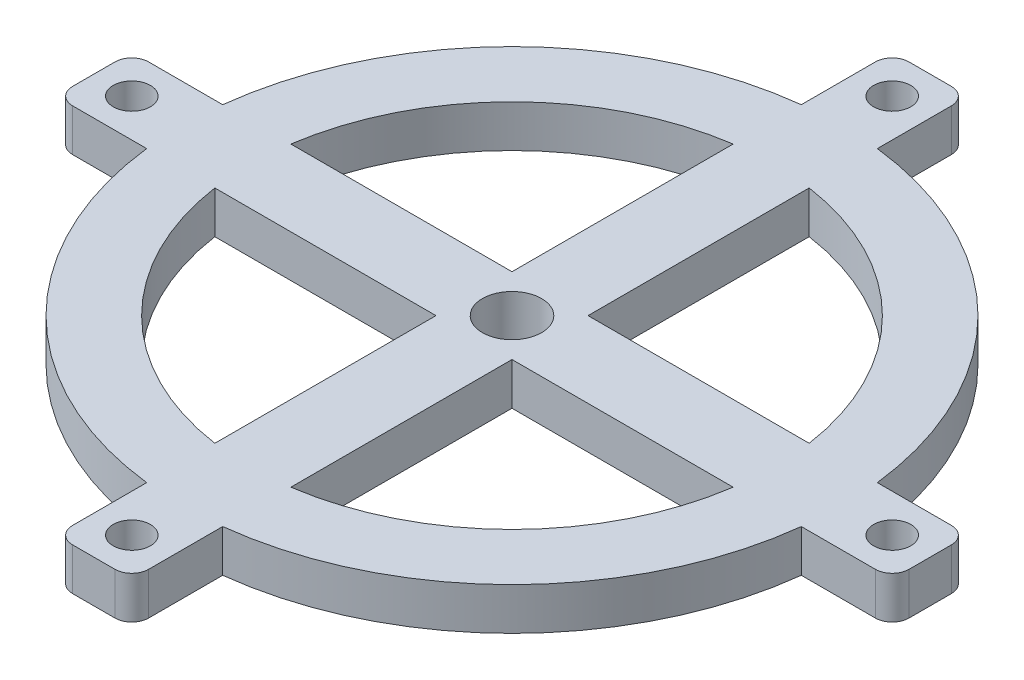
from build123d import *

# Parameters (mm, degrees)
CROQUIS1_W              = 4.5
CROQUIS1_H              = 4.5
SALIENTE_EXTRUIR1_DEPTH = 2.5
CROQUIS2_R              = 1.75
CROQUIS2_R_2            = 1.1
CORTAR_EXTRUIR1_DEPTH   = 2.5


with BuildPart() as part:
    # Croquis1 → Saliente-Extruir1 (new body)
    with BuildSketch(Plane(origin=(0, 0, 0), x_dir=(1, 0, 0), z_dir=(0, 1, 0))):
        with BuildLine():
            ThreePointArc((-19.369757355, -2.25), (-13.788582233, -13.788582233), (-2.25, -19.369757355))
            Line((-2.25, -19.369757355), (-2.25, -15.335824073))
            ThreePointArc((-2.25, -15.335824073), (-10.960155108, -10.960155108), (-15.335824073, -2.25))
            Line((-15.335824073, -2.25), (-19.369757355, -2.25))
        make_face()
        with BuildLine():
            Line((-23.75, -2.25), (-19.369757355, -2.25))
            ThreePointArc((-19.369757355, -2.25), (-19.5, 0), (-19.369757355, 2.25))
            Line((-19.369757355, 2.25), (-23.75, 2.25))
            ThreePointArc((-23.75, 2.25), (-24.457106781, 1.957106781), (-24.75, 1.25))
            Line((-24.75, 1.25), (-24.75, -1.25))
            ThreePointArc((-24.75, -1.25), (-24.457106781, -1.957106781), (-23.75, -2.25))
        make_face()
        with BuildLine():
            Line((15.335824073, -2.25), (19.369757355, -2.25))
            ThreePointArc((19.369757355, -2.25), (19.467412109, -1.126883218), (19.5, 0))
            ThreePointArc((19.5, 0), (19.467412109, 1.126883218), (19.369757355, 2.25))
            Line((19.369757355, 2.25), (15.335824073, 2.25))
            ThreePointArc((15.335824073, 2.25), (15.458901532, 1.127990884), (15.5, 0))
            ThreePointArc((15.5, 0), (15.458901532, -1.127990884), (15.335824073, -2.25))
        make_face()
        with BuildLine():
            ThreePointArc((-19.369757355, 2.25), (-19.5, 0), (-19.369757355, -2.25))
            Line((-19.369757355, -2.25), (-15.335824073, -2.25))
            ThreePointArc((-15.335824073, -2.25), (-15.5, 0), (-15.335824073, 2.25))
            Line((-15.335824073, 2.25), (-19.369757355, 2.25))
        make_face()
        with BuildLine():
            Line((-2.25, 23.75), (-2.25, 19.369757355))
            ThreePointArc((-2.25, 19.369757355), (0, 19.5), (2.25, 19.369757355))
            Line((2.25, 19.369757355), (2.25, 23.75))
            ThreePointArc((2.25, 23.75), (1.957106781, 24.457106781), (1.25, 24.75))
            Line((1.25, 24.75), (-1.25, 24.75))
            ThreePointArc((-1.25, 24.75), (-1.957106781, 24.457106781), (-2.25, 23.75))
        make_face()
        with BuildLine():
            ThreePointArc((-2.25, 19.369757355), (-13.788582233, 13.788582233), (-19.369757355, 2.25))
            Line((-19.369757355, 2.25), (-15.335824073, 2.25))
            ThreePointArc((-15.335824073, 2.25), (-10.960155108, 10.960155108), (-2.25, 15.335824073))
            Line((-2.25, 15.335824073), (-2.25, 19.369757355))
        make_face()
        with BuildLine():
            ThreePointArc((-2.25, -19.369757355), (0, -19.5), (2.25, -19.369757355))
            Line((2.25, -19.369757355), (2.25, -15.335824073))
            ThreePointArc((2.25, -15.335824073), (0, -15.5), (-2.25, -15.335824073))
            Line((-2.25, -15.335824073), (-2.25, -19.369757355))
        make_face()
        with BuildLine():
            ThreePointArc((2.25, 19.369757355), (0, 19.5), (-2.25, 19.369757355))
            Line((-2.25, 19.369757355), (-2.25, 15.335824073))
            ThreePointArc((-2.25, 15.335824073), (0, 15.5), (2.25, 15.335824073))
            Line((2.25, 15.335824073), (2.25, 19.369757355))
        make_face()
        with BuildLine():
            Line((15.335824073, 2.25), (19.369757355, 2.25))
            ThreePointArc((19.369757355, 2.25), (13.788582233, 13.788582233), (2.25, 19.369757355))
            Line((2.25, 19.369757355), (2.25, 15.335824073))
            ThreePointArc((2.25, 15.335824073), (10.960155108, 10.960155108), (15.335824073, 2.25))
        make_face()
        with BuildLine():
            ThreePointArc((19.5, 0), (19.467412109, -1.126883218), (19.369757355, -2.25))
            Line((19.369757355, -2.25), (23.75, -2.25))
            ThreePointArc((23.75, -2.25), (24.457106781, -1.957106781), (24.75, -1.25))
            Line((24.75, -1.25), (24.75, 1.25))
            ThreePointArc((24.75, 1.25), (24.457106781, 1.957106781), (23.75, 2.25))
            Line((23.75, 2.25), (19.369757355, 2.25))
            ThreePointArc((19.369757355, 2.25), (19.467412109, 1.126883218), (19.5, 0))
        make_face()
        with BuildLine():
            Line((-1.25, -24.75), (1.25, -24.75))
            ThreePointArc((1.25, -24.75), (1.957106781, -24.457106781), (2.25, -23.75))
            Line((2.25, -23.75), (2.25, -19.369757355))
            ThreePointArc((2.25, -19.369757355), (0, -19.5), (-2.25, -19.369757355))
            Line((-2.25, -19.369757355), (-2.25, -23.75))
            ThreePointArc((-2.25, -23.75), (-1.957106781, -24.457106781), (-1.25, -24.75))
        make_face()
        with BuildLine():
            Line((2.25, -15.335824073), (2.25, -19.369757355))
            ThreePointArc((2.25, -19.369757355), (13.788582233, -13.788582233), (19.369757355, -2.25))
            Line((19.369757355, -2.25), (15.335824073, -2.25))
            ThreePointArc((15.335824073, -2.25), (10.960155108, -10.960155108), (2.25, -15.335824073))
        make_face()
        with BuildLine():
            ThreePointArc((-2.25, -15.335824073), (0, -15.5), (2.25, -15.335824073))
            Line((2.25, -15.335824073), (2.25, -2.25))
            Line((2.25, -2.25), (-2.25, -2.25))
            Line((-2.25, -2.25), (-2.25, -15.335824073))
        make_face()
        with BuildLine():
            Line((-15.335824073, -2.25), (-2.25, -2.25))
            Line((-2.25, -2.25), (-2.25, 2.25))
            Line((-2.25, 2.25), (-15.335824073, 2.25))
            ThreePointArc((-15.335824073, 2.25), (-15.5, 0), (-15.335824073, -2.25))
        make_face()
        with BuildLine():
            Line((-2.25, 2.25), (2.25, 2.25))
            Line((2.25, 2.25), (2.25, 15.335824073))
            ThreePointArc((2.25, 15.335824073), (0, 15.5), (-2.25, 15.335824073))
            Line((-2.25, 15.335824073), (-2.25, 2.25))
        make_face()
        Rectangle(CROQUIS1_W, CROQUIS1_H)
        with BuildLine():
            Line((2.25, 2.25), (2.25, -2.25))
            Line((2.25, -2.25), (15.335824073, -2.25))
            ThreePointArc((15.335824073, -2.25), (15.458901532, -1.127990884), (15.5, 0))
            ThreePointArc((15.5, 0), (15.458901532, 1.127990884), (15.335824073, 2.25))
            Line((15.335824073, 2.25), (2.25, 2.25))
        make_face()
    extrude(amount=SALIENTE_EXTRUIR1_DEPTH)

    # Croquis2 → Cortar-Extruir1 (cut)
    with BuildSketch(Plane(origin=(0, 2.5, 0), x_dir=(1, 0, 0), z_dir=(0, 1, 0))):
        with Locations(Location((0, 0, 0), (0, 0, 270))):
            Circle(CROQUIS2_R)
        with Locations(Location((-22.5, 0, 0), (0, 0, 270))):
            Circle(CROQUIS2_R_2)
        with Locations(Location((0, 22.5, 0), (0, 0, 270))):
            Circle(CROQUIS2_R_2)
        with Locations(Location((22.5, 0, 0), (0, 0, 270))):
            Circle(CROQUIS2_R_2)
        with Locations(Location((0, -22.5, 0), (0, 0, 270))):
            Circle(CROQUIS2_R_2)
    extrude(amount=-CORTAR_EXTRUIR1_DEPTH, mode=Mode.SUBTRACT)


solid = part.part
